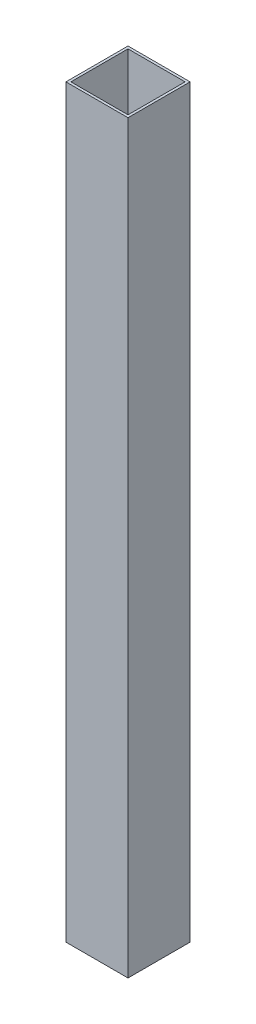
from build123d import *

# Parameters (mm, degrees)
SKETCH1_W           = 50
SKETCH1_H           = 50
SKETCH1_W_2         = 46
SKETCH1_H_2         = 46
BOSS_EXTRUDE1_DEPTH = 600


with BuildPart() as part:
    # Sketch1 → Boss-Extrude1 (new body)
    with BuildSketch(Plane(origin=(0, 0, 0), x_dir=(1, 0, 0), z_dir=(0, 1, 0))):
        Rectangle(SKETCH1_W, SKETCH1_H)
        Rectangle(SKETCH1_W_2, SKETCH1_H_2, mode=Mode.SUBTRACT)
    extrude(amount=BOSS_EXTRUDE1_DEPTH)


solid = part.part
